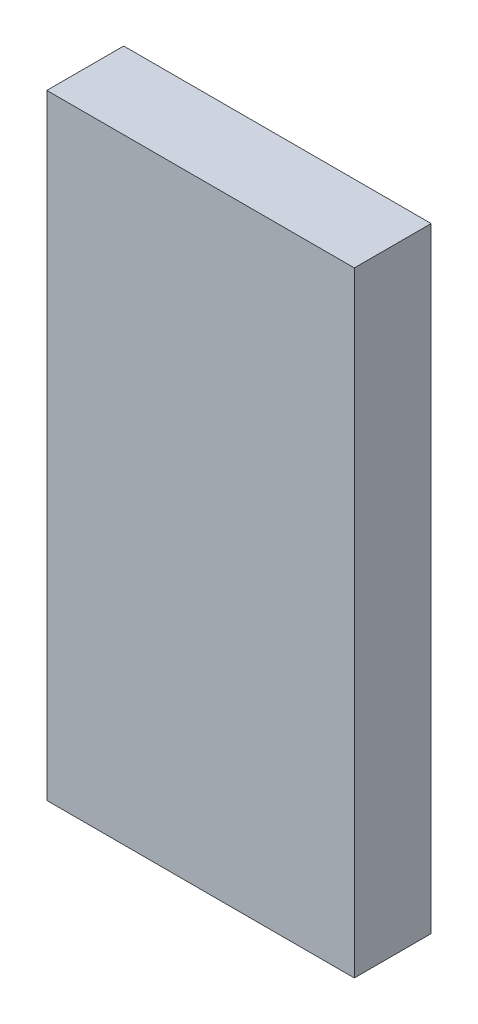
from build123d import *

# Parameters (mm, degrees)
SKETCH1_W           = 10
SKETCH1_H           = 20
BOSS_EXTRUDE1_DEPTH = 2.5


with BuildPart() as part:
    # Sketch1 → Boss-Extrude1 (new body)
    with BuildSketch(Plane.XY):
        Rectangle(SKETCH1_W, SKETCH1_H)
    extrude(amount=BOSS_EXTRUDE1_DEPTH)


solid = part.part
